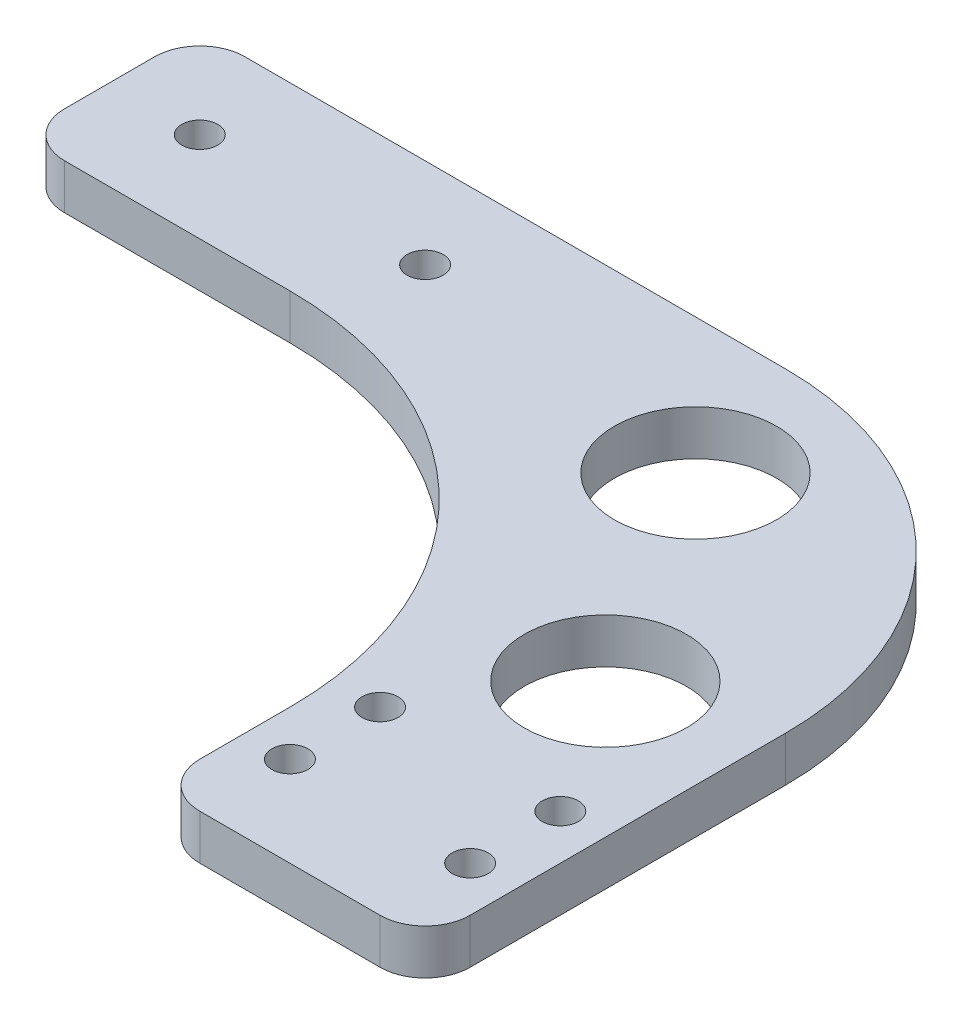
from build123d import *

# Parameters (mm, degrees)
EXTRUDE_1_DEPTH     = 5
FILLET_1_R          = 40
FILLET_2_R          = 5
SKETCH_2_R          = 2
CUT_EXTRUDE_1_DEPTH = 5
FILLET_3_R          = 35
SKETCH_3_R          = 9
CUT_EXTRUDE_2_DEPTH = 99.12125789
SKETCH_4_R          = 2
CUT_EXTRUDE_3_DEPTH = 99.12125789


with BuildPart() as part:
    # 草图1 → 凸台-拉伸1 (new body)
    with BuildSketch(Plane(origin=(0, 0, 0), x_dir=(1, 0, 0), z_dir=(0, 1, 0))):
        Polygon((-89.625, 35.375), (10.375, 35.375), (10.375, -39.625), (-19.625, -39.625), (-19.625, 15.375), (-89.625, 15.375), align=None)
    extrude(amount=EXTRUDE_1_DEPTH)

    # 圆角1
    fillet_1_edges = [part.edges().sort_by_distance(p)[0] for p in [
        (-19.625, 2.5, -15.375),
    ]]
    fillet(fillet_1_edges, radius=FILLET_1_R)

    # 圆角2
    fillet_2_edges = [part.edges().sort_by_distance(p)[0] for p in [
        (-89.625, 2.5, -35.375),
        (10.375, 2.5, 39.625),
        (-19.625, 2.5, 39.625),
        (-89.625, 2.5, -15.375),
    ]]
    fillet(fillet_2_edges, radius=FILLET_2_R)

    # 草图2 → 切除-拉伸1 (cut)
    with BuildSketch(Plane(origin=(0, 5, 0), x_dir=(1, 0, 0), z_dir=(0, 1, 0))):
        with Locations(Location((-14.625, -29.625, 0), (0, 0, 270))):
            Circle(SKETCH_2_R)
        with Locations(Location((5.375, -29.625, 0), (0, 0, 270))):
            Circle(SKETCH_2_R)
        with Locations(Location((5.375, -19.625, 0), (0, 0, 270))):
            Circle(SKETCH_2_R)
        with Locations(Location((-14.625, -19.625, 0), (0, 0, 270))):
            Circle(SKETCH_2_R)
    extrude(amount=-CUT_EXTRUDE_1_DEPTH, mode=Mode.SUBTRACT)

    # 圆角3
    fillet_3_edges = [part.edges().sort_by_distance(p)[0] for p in [
        (10.375, 2.5, -35.375),
    ]]
    fillet(fillet_3_edges, radius=FILLET_3_R)

    # 草图3 → 切除-拉伸2 (cut, through all)
    with BuildSketch(Plane(origin=(0, 5, 0), x_dir=(1, 0, 0), z_dir=(0, 1, 0))):
        with Locations(Location((-19.625, 20.375, 0), (0, 0, 270))):
            Circle(SKETCH_3_R)
        with Locations(Location((-4.625, -4.625, 0), (0, 0, 270))):
            Circle(SKETCH_3_R)
    extrude(amount=-CUT_EXTRUDE_2_DEPTH, mode=Mode.SUBTRACT)

    # 草图4 → 切除-拉伸3 (cut, through all)
    with BuildSketch(Plane(origin=(0, 5, 0), x_dir=(1, 0, 0), z_dir=(0, 1, 0))):
        with Locations(Location((-79.625, 25.375, 0), (0, 0, 270))):
            Circle(SKETCH_4_R)
        with Locations(Location((-54.625, 25.375, 0), (0, 0, 270))):
            Circle(SKETCH_4_R)
    extrude(amount=-CUT_EXTRUDE_3_DEPTH, mode=Mode.SUBTRACT)


solid = part.part
